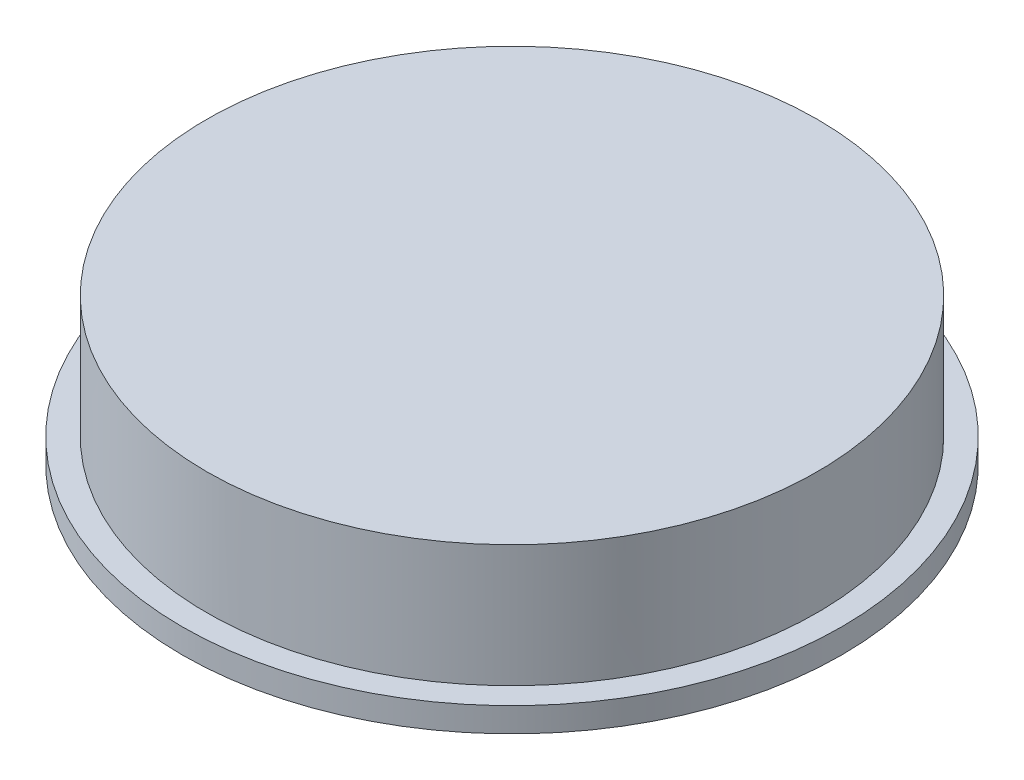
from build123d import *

# Parameters (mm, degrees)
SKETCH3_W           = 7.785
SKETCH3_H           = 7.785
SKETCH3_W_2         = 3.785
SKETCH3_H_2         = 3.785
BOSS_EXTRUDE1_DEPTH = 4
SKETCH4_R           = 12.5
BOSS_EXTRUDE2_DEPTH = 6
SKETCH5_R           = 13.5
BOSS_EXTRUDE3_DEPTH = 1
FILLET1_R           = 1


with BuildPart() as part:
    # Sketch3 → Boss-Extrude1 (new body)
    with BuildSketch(Plane(origin=(0, 0, 0), x_dir=(1, 0, 0), z_dir=(0, 1, 0))):
        Rectangle(SKETCH3_W, SKETCH3_H)
        Rectangle(SKETCH3_W_2, SKETCH3_H_2, mode=Mode.SUBTRACT)
    extrude(amount=BOSS_EXTRUDE1_DEPTH)

    # Sketch4 → Boss-Extrude2 (add)
    with BuildSketch(Plane(origin=(0, 4, 0), x_dir=(1, 0, 0), z_dir=(0, 1, 0))):
        with Locations(Location((0, 0, 0), (0, 0, 270))):
            Circle(SKETCH4_R)
    extrude(amount=BOSS_EXTRUDE2_DEPTH)

    # Sketch5 → Boss-Extrude3 (add)
    with BuildSketch(Plane.XZ.offset(-4)):
        with Locations(Location((0, 0, 0), (0, 0, 270))):
            Circle(SKETCH5_R)
    extrude(amount=-BOSS_EXTRUDE3_DEPTH)

    # Fillet1
    fillet1_edges = [part.edges().sort_by_distance(p)[0] for p in [
        (3.8925, 2, 3.8925),
        (-3.8925, 2, 3.8925),
        (-3.8925, 2, -3.8925),
        (3.8925, 2, -3.8925),
    ]]
    fillet(fillet1_edges, radius=FILLET1_R)


solid = part.part
